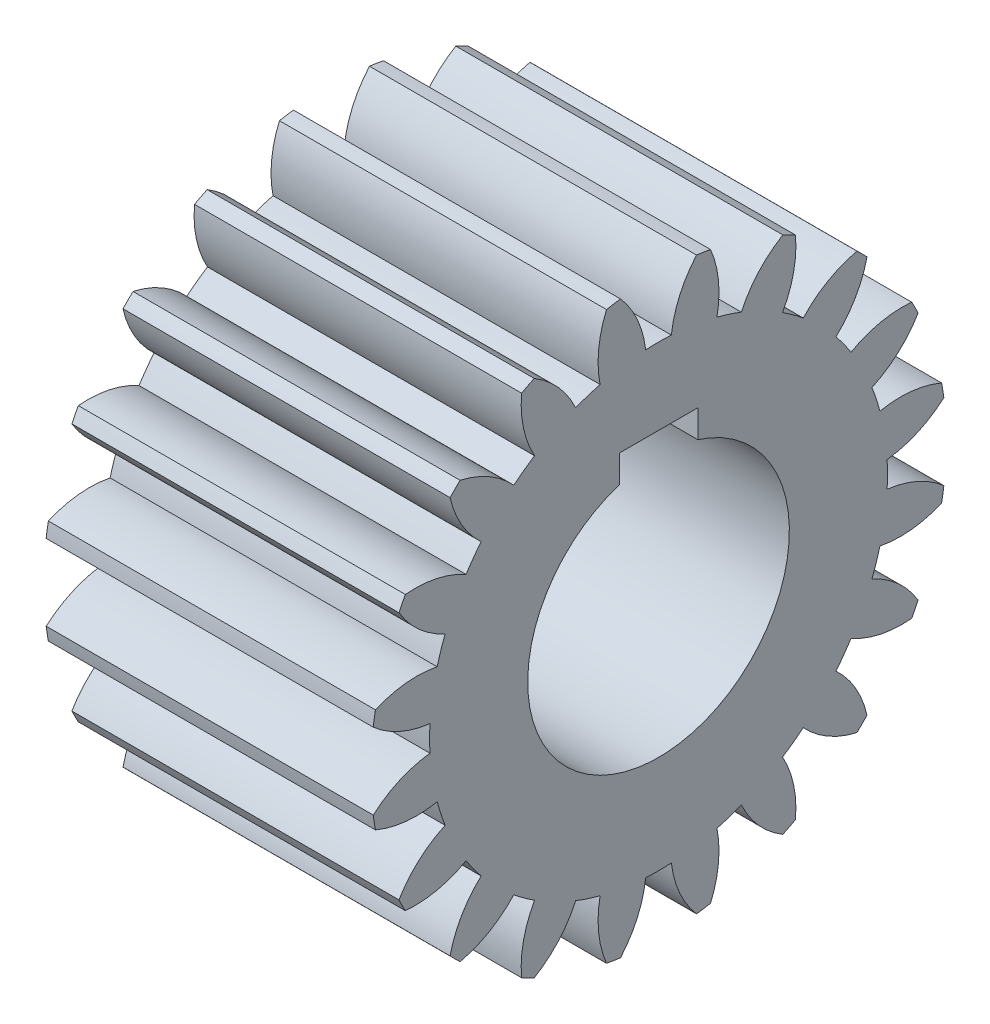
from build123d import *

# Parameters (mm, degrees)
BASPROSKE_W     = 50
BASPROSKE_H     = 44
TOOTHCUT_DEPTH  = 80.824808174
TEETHCUTS_COUNT = 20
TEETHCUTS_ANGLE = 342
BORSKE_R        = 20
BORE_DEPTH      = 50.0000508
KEYSKE_W        = 12
KEYSKE_H        = 23.3
KEYWAY_DEPTH    = 50.0000508


with BuildPart() as part:
    # BasProSke → Base-Revolve (revolve)
    with BuildSketch(Plane(origin=(0, 0, 0), x_dir=(1, 0, 0), z_dir=(0, 1, 0)), mode=Mode.PRIVATE) as base_revolve_sk:
        with Locations((25, 22)):
            Rectangle(BASPROSKE_W, BASPROSKE_H)
    revolve(base_revolve_sk.sketch.rotate(Axis((-10, 0, 0), (1, 0, 0)), 180), axis=Axis((-10, 0, 0), (1, 0, 0)))

    # TooCutSke → ToothCut (cut, through all)
    with BuildSketch(Plane(origin=(0, 0, 0), x_dir=(0, 0, -1), z_dir=(1, 0, 0))):
        with BuildLine():
            ThreePointArc((1.961730392, 34.943978235), (0, 34.999), (-1.961730392, 34.943978235))
            ThreePointArc((-1.961730392, 34.943978235), (-3.235659864, 39.585086827), (-5.832115241, 43.637395396))
            ThreePointArc((-5.832115241, 43.637395396), (0, 44.0254), (5.832115241, 43.637395396))
            ThreePointArc((5.832115241, 43.637395396), (3.235659864, 39.585086827), (1.961730392, 34.943978235))
        make_face()
    toothcut = extrude(amount=TOOTHCUT_DEPTH, mode=Mode.SUBTRACT)

    # TeethCuts: ToothCut ×20 about axis
    teethcuts_axis = Axis((-10, 0, 0), (1, 0, 0))
    for i in range(1, TEETHCUTS_COUNT):
        add(toothcut.rotate(teethcuts_axis, i * TEETHCUTS_ANGLE / (TEETHCUTS_COUNT - 1)), mode=Mode.SUBTRACT)

    # BorSke → Bore (cut, symmetric)
    with BuildSketch(Plane(origin=(0, 0, 0), x_dir=(0, 0, -1), z_dir=(1, 0, 0))):
        with Locations(Location((0, 0, 0), (0, 0, 180))):
            Circle(BORSKE_R)
    extrude(amount=BORE_DEPTH, both=True, mode=Mode.SUBTRACT)

    # KeySke → Keyway (cut, symmetric)
    with BuildSketch(Plane(origin=(0, 0, 0), x_dir=(0, 0, -1), z_dir=(1, 0, 0))):
        with Locations((0, 11.65)):
            Rectangle(KEYSKE_W, KEYSKE_H)
    extrude(amount=KEYWAY_DEPTH, both=True, mode=Mode.SUBTRACT)


solid = part.part
